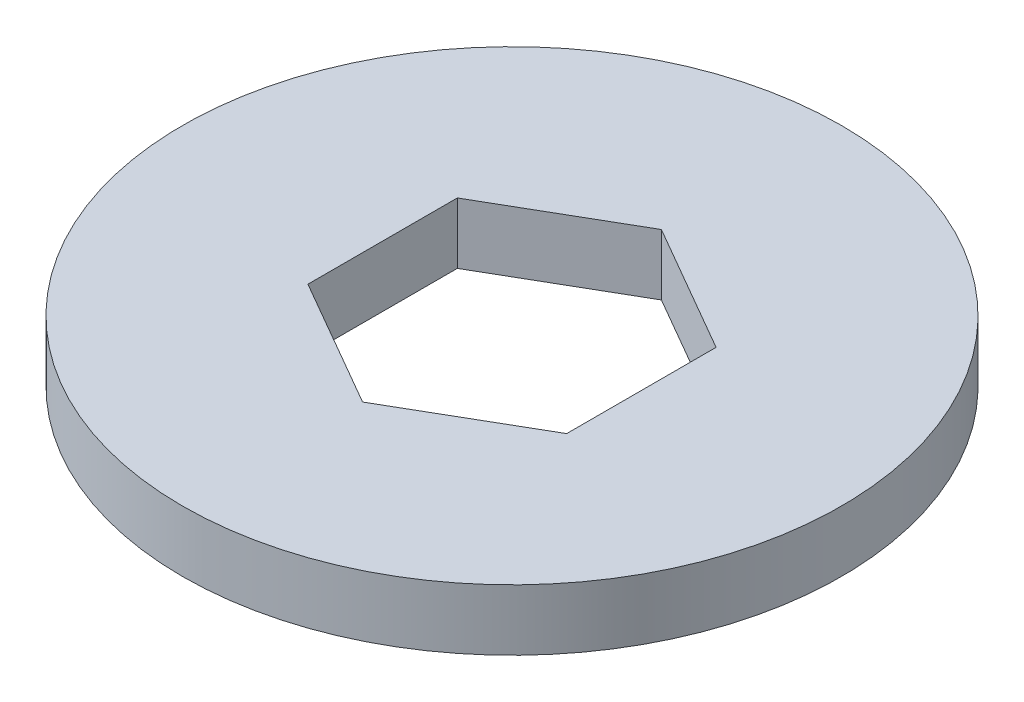
from build123d import *

# Parameters (mm, degrees)
SKETCH_1_R      = 13.5
EXTRUDE_1_DEPTH = 2.5


with BuildPart() as part:
    # 草图1 → 凸台-拉伸1 (new body)
    with BuildSketch(Plane(origin=(0, 0, 0), x_dir=(1, 0, 0), z_dir=(0, 1, 0))):
        with Locations(Location((0, 0, 0), (0, 0, 90))):
            Circle(SKETCH_1_R)
        Polygon((0, -6.119912853), (5.3, -3.059956427), (5.3, 3.059956427), (0, 6.119912853), (-5.3, 3.059956427), (-5.3, -3.059956427), align=None, mode=Mode.SUBTRACT)
    extrude(amount=EXTRUDE_1_DEPTH)


solid = part.part
